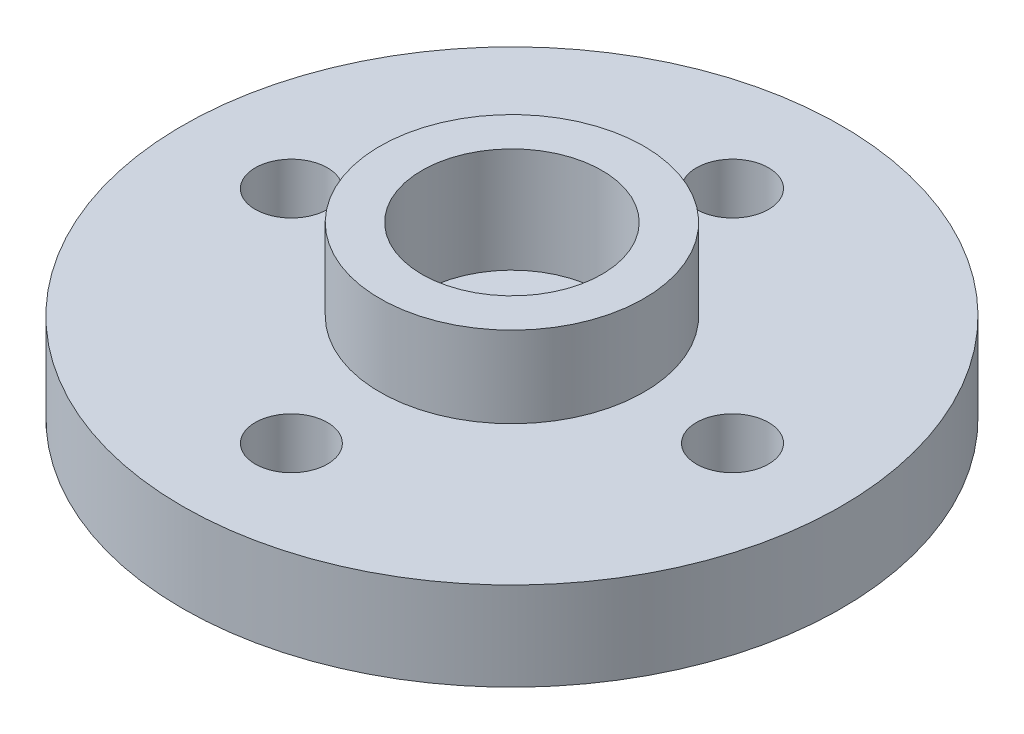
from build123d import *

# Parameters (mm, degrees)
CROQUIS_BASE_R          = 10.982321859
SALIENTE_EXTRUIR1_DEPTH = 2.95
CROQUIS_BASE_3_R        = 1.568903123
CROQUIS_BASE_3_R_2      = 1.202825727
CORTAR_EXTRUIR1_DEPTH   = 2.95
CROQUIS_BASE_4_R        = 3.137806245
CORTAR_EXTRUIR2_DEPTH   = 1.05
CROQUIS2_R              = 4.4
SALIENTE_EXTRUIR2_DEPTH = 2.7
CROQUIS3_R              = 3
CORTAR_EXTRUIR3_DEPTH   = 3.5


with BuildPart() as part:
    # Croquis base → Saliente-Extruir1 (new body)
    with BuildSketch(Plane(origin=(0, 0, 0), x_dir=(1, 0, 0), z_dir=(0, 1, 0))):
        Circle(CROQUIS_BASE_R)
    extrude(amount=SALIENTE_EXTRUIR1_DEPTH)

    # Croquis base<3> → Cortar-Extruir1 (cut)
    with BuildSketch(Plane(origin=(0, 0, 0), x_dir=(1, 0, 0), z_dir=(0, 1, 0))):
        Circle(CROQUIS_BASE_3_R)
        with Locations((-7.35, 0)):
            Circle(CROQUIS_BASE_3_R_2)
        with Locations((0, 7.35)):
            Circle(CROQUIS_BASE_3_R_2)
        with Locations((7.35, 0)):
            Circle(CROQUIS_BASE_3_R_2)
        with Locations((0, -7.35)):
            Circle(CROQUIS_BASE_3_R_2)
    extrude(amount=CORTAR_EXTRUIR1_DEPTH, mode=Mode.SUBTRACT)

    # Croquis base<4> → Cortar-Extruir2 (cut)
    with BuildSketch(Plane(origin=(0, 0, 0), x_dir=(1, 0, 0), z_dir=(0, 1, 0))):
        Circle(CROQUIS_BASE_4_R)
    extrude(amount=CORTAR_EXTRUIR2_DEPTH, mode=Mode.SUBTRACT)

    # Croquis2 → Saliente-Extruir2 (add)
    with BuildSketch(Plane(origin=(0, 2.95, 0), x_dir=(1, 0, 0), z_dir=(0, 1, 0))):
        Circle(CROQUIS2_R)
    extrude(amount=SALIENTE_EXTRUIR2_DEPTH)

    # Croquis3 → Cortar-Extruir3 (cut)
    with BuildSketch(Plane(origin=(0, 5.65, 0), x_dir=(1, 0, 0), z_dir=(0, 1, 0))):
        Circle(CROQUIS3_R)
    extrude(amount=-CORTAR_EXTRUIR3_DEPTH, mode=Mode.SUBTRACT)


solid = part.part
